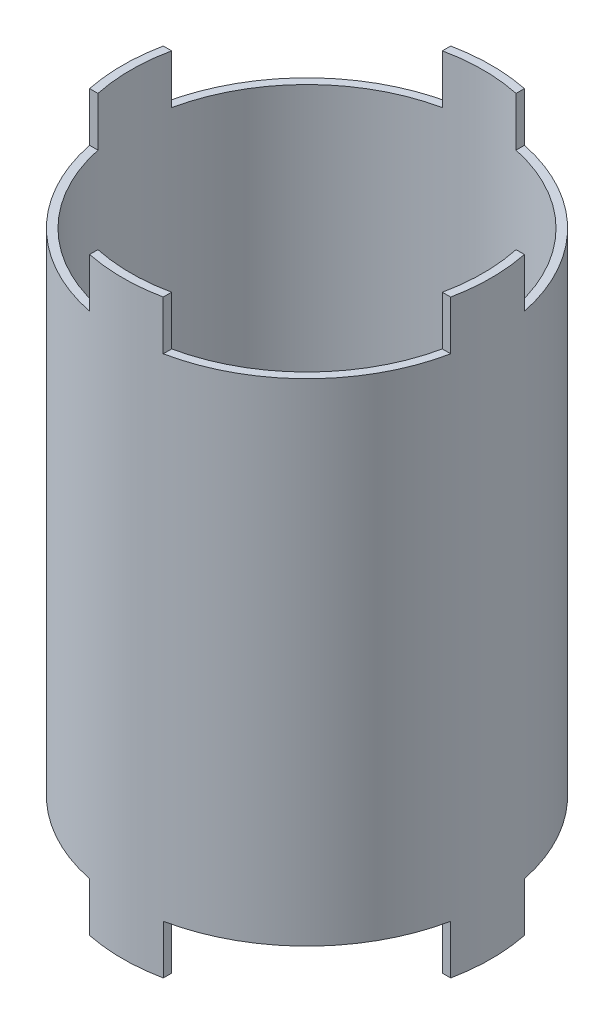
from build123d import *
from build123d.topology import SkipClean

# Parameters (mm, degrees)
SKETCH1_R           = 57.15
SKETCH1_R_2         = 54.61
BOSS_EXTRUDE1_DEPTH = 152.4
BOSS_EXTRUDE2_DEPTH = 15.24
BOSS_EXTRUDE3_START = 15.24
BOSS_EXTRUDE3_DEPTH = 15.24


with BuildPart() as part:
    # Sketch1 → Boss-Extrude1 (new body)
    with BuildSketch(Plane(origin=(0, 0, 0), x_dir=(1, 0, 0), z_dir=(0, 1, 0))):
        with Locations(Location((0, 0, 0), (0, 0, 90))):
            Circle(SKETCH1_R)
        with Locations(Location((0, 0, 0), (0, 0, 90))):
            Circle(SKETCH1_R_2, mode=Mode.SUBTRACT)
    extrude(amount=BOSS_EXTRUDE1_DEPTH)

    # Sketch2 → Boss-Extrude2 (add)
    with SkipClean():  # the faces are left unmerged after this step: merging them gives an invalid solid
        with BuildSketch(Plane(origin=(0, 152.4, 0), x_dir=(1, 0, 0), z_dir=(0, 1, 0))):
            with BuildLine():
                Line((-55.99533552, 11.43), (-53.400441946, 11.43))
                ThreePointArc((-53.400441946, 11.43), (-54.61, 0), (-53.400441946, -11.43))
                Line((-53.400441946, -11.43), (-55.99533552, -11.43))
                ThreePointArc((-55.99533552, -11.43), (-57.15, 0), (-55.99533552, 11.43))
            make_face()
            with BuildLine():
                Line((11.43, 53.400441946), (11.43, 55.99533552))
                ThreePointArc((11.43, 55.99533552), (0, 57.15), (-11.43, 55.99533552))
                Line((-11.43, 55.99533552), (-11.43, 53.400441946))
                ThreePointArc((-11.43, 53.400441946), (0, 54.61), (11.43, 53.400441946))
            make_face()
            with BuildLine():
                Line((53.400441946, 11.43), (55.99533552, 11.43))
                ThreePointArc((55.99533552, 11.43), (57.15, 0), (55.99533552, -11.43))
                Line((55.99533552, -11.43), (53.400441946, -11.43))
                ThreePointArc((53.400441946, -11.43), (54.61, 0), (53.400441946, 11.43))
            make_face()
            with BuildLine():
                Line((-11.43, -53.400441946), (-11.43, -55.99533552))
                ThreePointArc((-11.43, -55.99533552), (-0.008316105, -57.149999395), (11.413703346, -55.998659591))
                Line((11.413703346, -55.998659591), (11.43, -53.400441946))
                ThreePointArc((11.43, -53.400441946), (0, -54.61), (-11.43, -53.400441946))
            make_face()
        extrude(amount=BOSS_EXTRUDE2_DEPTH)

    # Sketch3 → Boss-Extrude3 (add)
    with SkipClean():  # the faces are left unmerged after this step: merging them gives an invalid solid
        with BuildSketch(Plane.XZ.offset(BOSS_EXTRUDE3_START)):
            with BuildLine():
                Line((11.43, 55.99533552), (11.43, 53.400441946))
                ThreePointArc((11.43, 53.400441946), (0, 54.61), (-11.43, 53.400441946))
                Line((-11.43, 53.400441946), (-11.43, 55.99533552))
                ThreePointArc((-11.43, 55.99533552), (0, 57.15), (11.43, 55.99533552))
            make_face()
            with BuildLine():
                Line((53.400441946, 11.43), (55.99533552, 11.43))
                ThreePointArc((55.99533552, 11.43), (57.15, 0), (55.99533552, -11.43))
                Line((55.99533552, -11.43), (53.400441946, -11.43))
                ThreePointArc((53.400441946, -11.43), (54.61, 0), (53.400441946, 11.43))
            make_face()
            with BuildLine():
                Line((-11.43, -53.400441946), (-11.43, -55.99533552))
                ThreePointArc((-11.43, -55.99533552), (0, -57.15), (11.43, -55.99533552))
                Line((11.43, -55.99533552), (11.43, -53.400441946))
                ThreePointArc((11.43, -53.400441946), (0, -54.61), (-11.43, -53.400441946))
            make_face()
            with BuildLine():
                Line((-55.99533552, 11.43), (-53.400441946, 11.43))
                ThreePointArc((-53.400441946, 11.43), (-54.61, 0), (-53.400441946, -11.43))
                Line((-53.400441946, -11.43), (-55.99533552, -11.43))
                ThreePointArc((-55.99533552, -11.43), (-57.15, 0), (-55.99533552, 11.43))
            make_face()
        extrude(amount=-BOSS_EXTRUDE3_DEPTH)


solid = part.part
